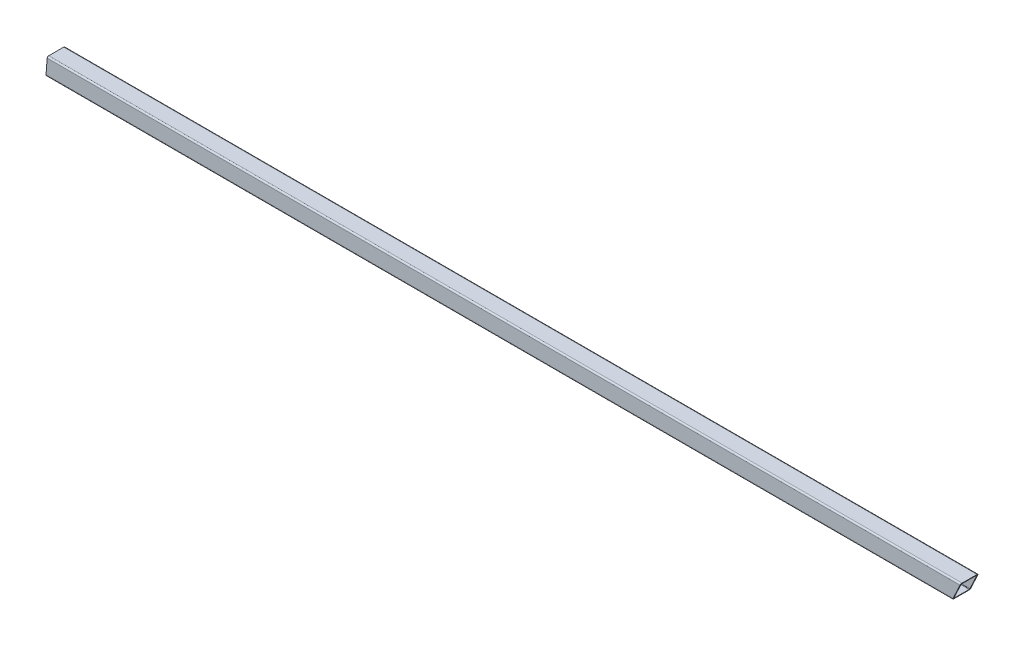
from build123d import *

# Parameters (mm, degrees)
BOSS_EXTRUDE1_DEPTH = 1320.8
SCALE4_SCALE_X      = 1
SCALE4_SCALE_Y      = 0.4
SCALE4_SCALE_Z      = 0.4
CUT_EXTRUDE1_DEPTH  = 1322.04802369


with BuildPart() as part:
    # Sketch1 → Boss-Extrude1 (new body)
    with BuildSketch(Plane(origin=(0, 0, 0), x_dir=(0, 0, -1), z_dir=(1, 0, 0))):
        with BuildLine():
            Line((0, 2.54), (0, 29.21))
            ThreePointArc((0, 29.21), (-0.743948776, 31.006051224), (-2.54, 31.75))
            Line((-2.54, 31.75), (-29.21, 31.75))
            ThreePointArc((-29.21, 31.75), (-31.006051224, 31.006051224), (-31.75, 29.21))
            Line((-31.75, 29.21), (-31.75, 2.54))
            ThreePointArc((-31.75, 2.54), (-31.006051224, 0.743948776), (-29.21, 0))
            Line((-29.21, 0), (-2.54, 0))
            ThreePointArc((-2.54, 0), (-0.743948776, 0.743948776), (0, 2.54))
        make_face()
        with BuildLine():
            Line((-1.651, 2.54), (-1.651, 29.21))
            ThreePointArc((-1.651, 29.21), (-1.911382072, 29.838617928), (-2.54, 30.099))
            Line((-2.54, 30.099), (-29.21, 30.099))
            ThreePointArc((-29.21, 30.099), (-29.838617928, 29.838617928), (-30.099, 29.21))
            Line((-30.099, 29.21), (-30.099, 2.54))
            ThreePointArc((-30.099, 2.54), (-29.838617928, 1.911382072), (-29.21, 1.651))
            Line((-29.21, 1.651), (-2.54, 1.651))
            ThreePointArc((-2.54, 1.651), (-1.911382072, 1.911382072), (-1.651, 2.54))
        make_face(mode=Mode.SUBTRACT)
    extrude(amount=BOSS_EXTRUDE1_DEPTH)


with BuildPart() as part_1:
    # Scale4: scaled about (660.4, 15.875, 15.875)
    add(part.part.scale((SCALE4_SCALE_X, SCALE4_SCALE_Y, SCALE4_SCALE_Z), about=(660.4, 15.875, 15.875)))

    # Sketch3 → Cut-Extrude1 (cut, through all)
    with BuildSketch(Plane(origin=(0, 0, 9.525), x_dir=(-1, 0, 0), z_dir=(0, 0, -1))):
        Polygon((-1320.8, 22.225), (-1314.877892741, 9.525), (-1320.8, 9.525), align=None)
        Polygon((-670.100451899, 22.225), (-669.099476758, 9.525), (-619.573747082, 9.525), (-619.573747082, 22.225), align=None)
    extrude(amount=-CUT_EXTRUDE1_DEPTH, mode=Mode.SUBTRACT)


with BuildPart() as cut_extrude1_kept_piece:
    # of the separate pieces the step leaves, the one the design keeps (cut_extrude1_pieces_kept)
    add(part_1.part.solids().sort_by_distance((670.020373888, 21.209, 9.525))[0])


solid = cut_extrude1_kept_piece.part
